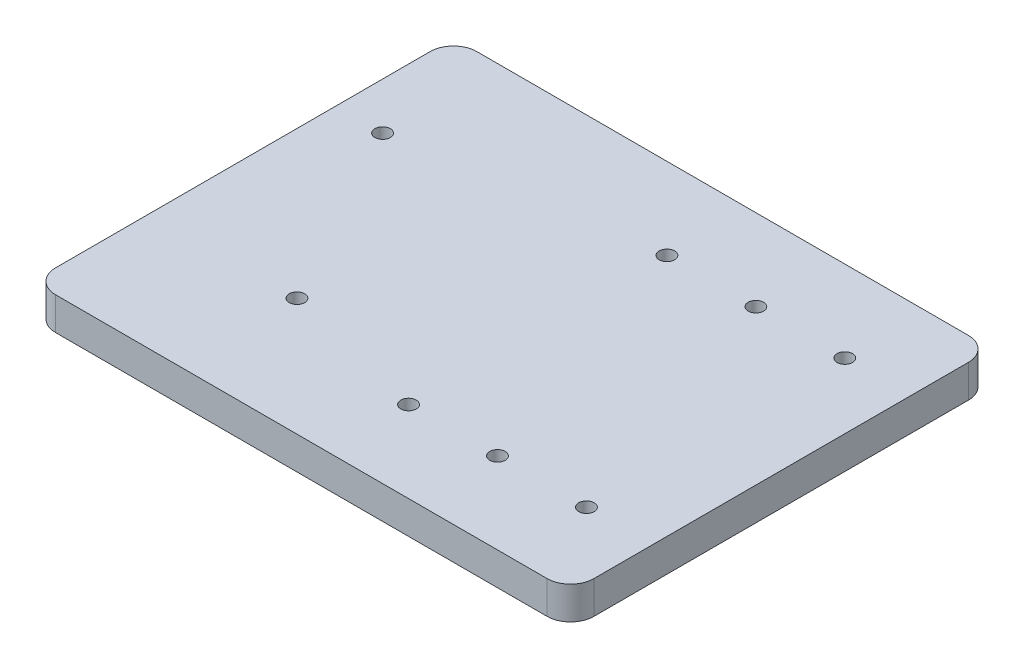
from build123d import *

# Parameters (mm, degrees)
SKETCH1_W               = 115
SKETCH1_H               = 90
SKETCH1_R               = 1.65
BOSS_EXTRUDE2_DEPTH     = 7
CUT_EXTRUDE4_DEPTH      = 147.198495204
CUT_EXTRUDE4_DEPTH_BACK = 147.198495204
SKETCH5_R               = 1.65
FILLET1_R               = 5
SKETCH8_R               = 3.5
CUT_EXTRUDE6_DEPTH      = 4


with BuildPart() as part:
    # Sketch1 → Boss-Extrude2 (new body)
    with BuildSketch(Plane(origin=(0, 0, 0), x_dir=(1, 0, 0), z_dir=(0, 1, 0))):
        with Locations((57.5, 45)):
            Rectangle(SKETCH1_W, SKETCH1_H)
        with Locations(Location((10, 64.85, 0), (0, 0, 270))):
            Circle(SKETCH1_R, mode=Mode.SUBTRACT)
        with Locations(Location((31.4, 25.15, 0), (0, 0, 270))):
            Circle(SKETCH1_R, mode=Mode.SUBTRACT)
    extrude(amount=BOSS_EXTRUDE2_DEPTH)

    # Sketch5 → Cut-Extrude4 (cut, two sides: drawn at the far end of the back side and taken through both)
    with BuildSketch(Plane(origin=(0, 0, 0), x_dir=(-1, 0, 0), z_dir=(0, -1, 0)).offset(-CUT_EXTRUDE4_DEPTH_BACK)):
        with Locations(Location((-101, 17.4, 0), (0, 0, 90))):
            Circle(SKETCH5_R)
        with Locations(Location((-101, 72.6, 0), (0, 0, 90))):
            Circle(SKETCH5_R)
        with Locations(Location((-82, 17.4, 0), (0, 0, 90))):
            Circle(SKETCH5_R)
        with Locations(Location((-82, 72.6, 0), (0, 0, 90))):
            Circle(SKETCH5_R)
        with Locations(Location((-63, 17.4, 0), (0, 0, 90))):
            Circle(SKETCH5_R)
        with Locations(Location((-63, 72.6, 0), (0, 0, 90))):
            Circle(SKETCH5_R)
    extrude(amount=CUT_EXTRUDE4_DEPTH + CUT_EXTRUDE4_DEPTH_BACK, mode=Mode.SUBTRACT)

    # Fillet1
    fillet1_edges = [part.edges().sort_by_distance(p)[0] for p in [
        (0, 3.5, -90),
        (115, 3.5, -90),
        (115, 3.5, 0),
        (0, 3.5, 0),
    ]]
    fillet(fillet1_edges, radius=FILLET1_R)

    # Sketch8 → Cut-Extrude6 (cut)
    with BuildSketch(Plane.XZ):
        with Locations(Location((31.4, -25.15, 0), (0, 0, 270))):
            Circle(SKETCH8_R)
        with Locations(Location((10, -64.85, 0), (0, 0, 270))):
            Circle(SKETCH8_R)
        with Locations(Location((63, -72.6, 0), (0, 0, 270))):
            Circle(SKETCH8_R)
        with Locations(Location((82, -72.6, 0), (0, 0, 270))):
            Circle(SKETCH8_R)
        with Locations(Location((101, -72.6, 0), (0, 0, 270))):
            Circle(SKETCH8_R)
        with Locations(Location((63, -17.4, 0), (0, 0, 270))):
            Circle(SKETCH8_R)
        with Locations(Location((82, -17.4, 0), (0, 0, 270))):
            Circle(SKETCH8_R)
        with Locations(Location((101, -17.4, 0), (0, 0, 270))):
            Circle(SKETCH8_R)
    extrude(amount=-CUT_EXTRUDE6_DEPTH, mode=Mode.SUBTRACT)


solid = part.part
